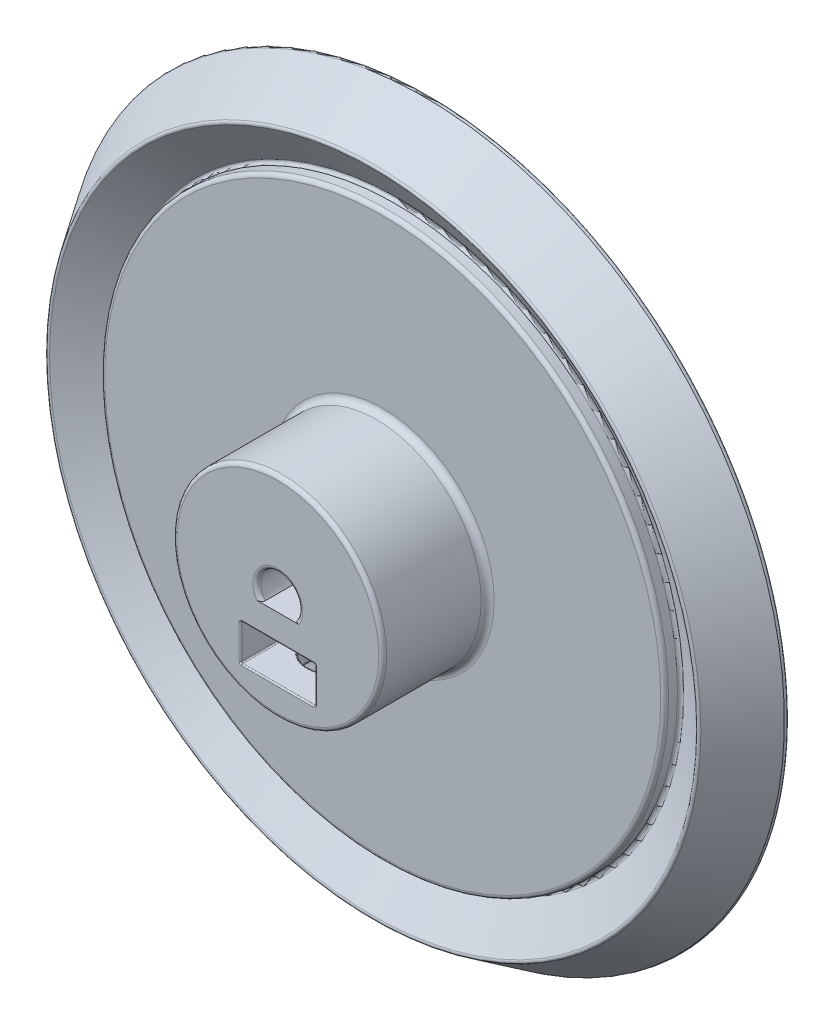
from build123d import *

# Parameters (mm, degrees)
SKETCH1_R           = 25
BOSS_EXTRUDE1_DEPTH = 3.85
SKETCH4_R           = 8
BOSS_EXTRUDE2_DEPTH = 8
CUT_EXTRUDE1_DEPTH  = 9
SKETCH6_R           = 2
CUT_EXTRUDE2_DEPTH  = 38.2883695
FILLET1_R           = 0.5
FILLET2_R           = 0.3
FILLET3_R           = 0.3
FILLET4_R           = 0.3
FILLET5_R           = 0.3
SKETCH8_W           = 5.7
SKETCH8_H           = 2.8
CUT_EXTRUDE3_DEPTH  = 9
FILLET6_R           = 0.1
FILLET7_R           = 0.2


with BuildPart() as part:
    # Sketch1 → Boss-Extrude1 (new, symmetric)
    with BuildSketch(Plane.XY):
        with Locations(Location((0, 0, 0), (0, 0, 180))):
            Circle(SKETCH1_R)
    extrude(amount=BOSS_EXTRUDE1_DEPTH, both=True)

    # Cut-Sweep1: sweep along a curve in space
    with BuildLine() as cut_sweep1_path:
        ThreePointArc((25, 0, -3.85), (17.67766953, 17.67766953, -3.85), (0, 25, -3.85))
        ThreePointArc((0, 25, -3.85), (-17.67766953, 17.67766953, -3.85), (-25, 0, -3.85))
        ThreePointArc((-25, 0, -3.85), (-17.67766953, -17.67766953, -3.85), (0, -25, -3.85))
        ThreePointArc((0, -25, -3.85), (17.67766953, -17.67766953, -3.85), (25, 0, -3.85))
    # Sketch2 → Cut-Sweep1 (sweep, cut)
    with BuildSketch(Plane(origin=(0, 0, 0), x_dir=(1, 0, 0), z_dir=(0, 1, 0))):
        Polygon((21.5, 2.5), (27.936779512, 2.5), (27.936779512, -2.5), (21.5, -2.5), (21.5, -7.255807333), (28.612366523, -7.255807333), (28.612366523, 7.255807333), (21.5, 7.255807333), align=None)
    sweep(path=cut_sweep1_path.line, mode=Mode.SUBTRACT)

    # Sketch4 → Boss-Extrude2 (add)
    with BuildSketch(Plane.XY.offset(3.85)):
        Circle(SKETCH4_R)
    extrude(amount=BOSS_EXTRUDE2_DEPTH)

    # Sketch5 → Cut-Extrude1 (cut)
    with BuildSketch(Plane.XY.offset(11.85)):
        with BuildLine():
            Line((-1.2489996, -1), (1.2489996, -1))
            ThreePointArc((1.2489996, -1), (0, 1.6), (-1.2489996, -1))
        make_face()
    extrude(amount=-CUT_EXTRUDE1_DEPTH, mode=Mode.SUBTRACT)

    # Sketch6 → Cut-Extrude2 (cut, through all)
    with BuildSketch(Plane(origin=(0, 0, 0), x_dir=(1, 0, 0), z_dir=(0, 1, 0))):
        with Locations(Location((0, -7.55, 0), (0, 0, 270))):
            Circle(SKETCH6_R)
    extrude(amount=-CUT_EXTRUDE2_DEPTH, mode=Mode.SUBTRACT)

    # Fillet1
    fillet1_edges = [part.edges().sort_by_distance(p)[0] for p in [
        (-8, 0, 3.85),
    ]]
    fillet(fillet1_edges, radius=FILLET1_R)

    # Sketch10 → Cut-Revolve1 (revolve, cut)
    with BuildSketch(Plane(origin=(0, 0, 0), x_dir=(0, 0, -1), z_dir=(1, 0, 0)), mode=Mode.PRIVATE) as cut_revolve1_sk:
        Polygon((-2.5, 21.5), (-4.701834862, 24.839449541), (-0.527522936, 27.591743119), (2.5, 23), (5.979270065, 25.449574005), (0.925728561, 30.470497043), (-10.106670073, 28.985393339), (-7.143723173, 23.348448783), align=None)
    revolve(cut_revolve1_sk.sketch.rotate(Axis((0, 0, 0), (0, 0, -1)), 90), axis=Axis((0, 0, 0), (0, 0, -1)), mode=Mode.SUBTRACT)

    # Sketch11 → Revolve3 (revolve)
    with BuildSketch(Plane(origin=(0, 0, 0), x_dir=(0, 0, -1), z_dir=(1, 0, 0)), mode=Mode.PRIVATE) as revolve3_sk:
        Polygon((2.5, 23), (2.5, 21.5), (-2.5, 21.5), (-4.701834862, 24.839449541), (-0.527522936, 27.591743119), align=None)
    revolve(revolve3_sk.sketch.rotate(Axis((0, 0, 0), (0, 0, -1)), 90), axis=Axis((0, 0, 0), (0, 0, -1)))

    # Fillet2
    fillet2_edges = [part.edges().sort_by_distance(p)[0] for p in [
        (-8, 0, 11.85),
    ]]
    fillet(fillet2_edges, radius=FILLET2_R)

    # Fillet3
    fillet3_edges = [part.edges().sort_by_distance(p)[0] for p in [
        (1e-09, -7.999999994, 5.549999986),
    ]]
    fillet(fillet3_edges, radius=FILLET3_R)

    # Fillet4
    fillet4_edges = [part.edges().sort_by_distance(p)[0] for p in [
        (0, 1.6, 11.85),
    ]]
    fillet(fillet4_edges, radius=FILLET4_R)

    # Fillet5
    fillet5_edges = [part.edges().sort_by_distance(p)[0] for p in [
        (0, 21.5, -2.5),
        (0, 21.5, -3.85),
        (0, 21.5, 3.85),
    ]]
    fillet(fillet5_edges, radius=FILLET5_R)

    # Sketch8 → Cut-Extrude3 (cut)
    with BuildSketch(Plane.XY.offset(11.85)):
        with Locations((0, -4.4)):
            Rectangle(SKETCH8_W, SKETCH8_H)
    extrude(amount=-CUT_EXTRUDE3_DEPTH, mode=Mode.SUBTRACT)

    # Fillet6
    fillet6_edges = [part.edges().sort_by_distance(p)[0] for p in [
        (0, -3, 2.85),
        (-2.85, -3, 7.35),
        (0, -3, 5.55),
        (0, -5.8, 2.85),
        (2.85, -5.8, 7.35),
        (0, -5.8, 5.55),
        (-2.85, -4.4, 2.85),
        (-2.85, -5.8, 7.35),
        (2.85, -4.4, 2.85),
        (2.85, -3, 7.35),
        (-2.85, -4.4, 11.85),
        (0, -5.8, 11.85),
        (2.85, -4.4, 11.85),
        (0, -3, 11.85),
    ]]
    fillet(fillet6_edges, radius=FILLET6_R)

    # Fillet7
    fillet7_edges = [part.edges().sort_by_distance(p)[0] for p in [
        (-23, 0, -2.5),
        (-24.839449541, 0, 4.701834862),
        (-27.591743119, 0, 0.527522936),
        (15.202795796, -15.202795796, 2.5),
    ]]
    fillet(fillet7_edges, radius=FILLET7_R)


solid = part.part
